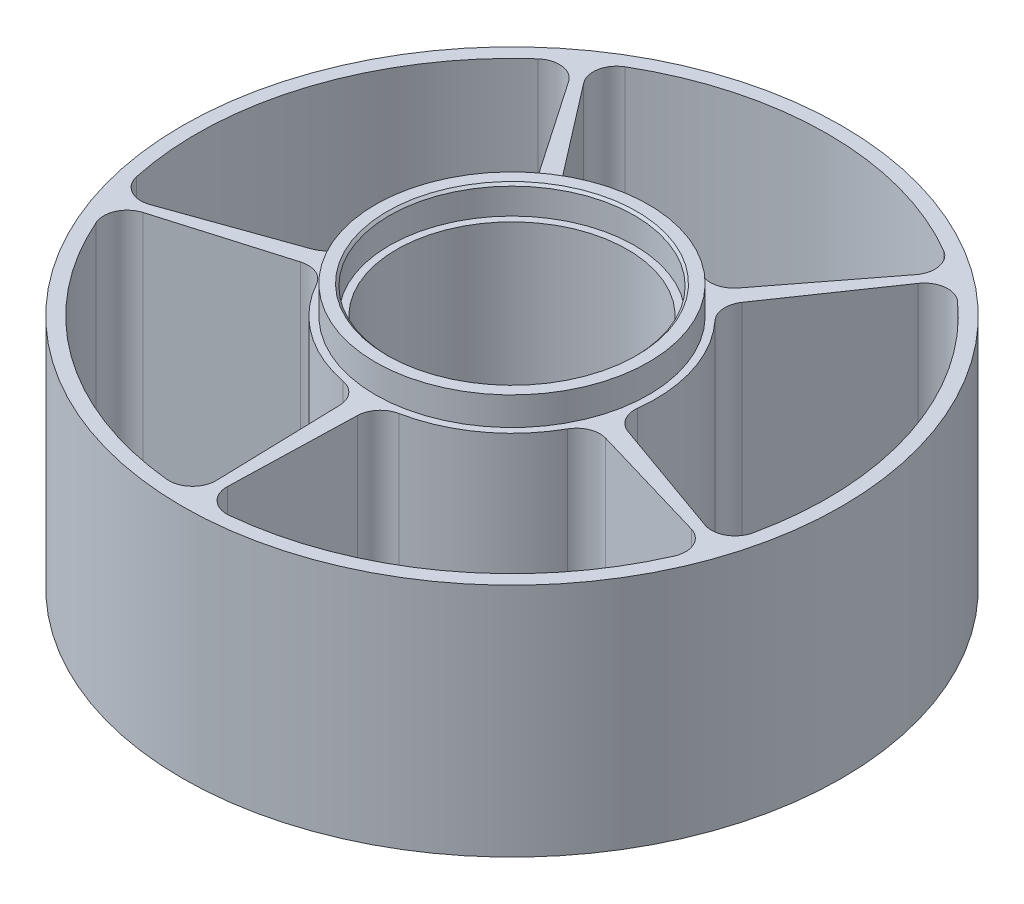
from build123d import *

# Parameters (mm, degrees)
SKETCH_1_W             = 6
SKETCH_1_H             = 50
SKETCH_1_W_2           = 3
HOLE_WIZARD_M4_1_D     = 3.3
HOLE_WIZARD_M4_1_DEPTH = 10
HOLE_WIZARD_M4_1_TIP   = 0.991420021
EXTRUDE_1_DEPTH        = 50
SKETCH_7_R             = 29
SKETCH_7_R_2           = 26
EXTRUDE_3_DEPTH        = 6
CHAMFER_1_SIZE         = 0.5
FILLET_1_R             = 5


with BuildPart() as part:
    # 草图1 → 旋转1 (revolve)
    with BuildSketch(Plane.XY, mode=Mode.PRIVATE) as revolve_1_sk:
        with Locations((27.5, 25)):
            Rectangle(SKETCH_1_W, SKETCH_1_H)
        with Locations((68.5, 25)):
            Rectangle(SKETCH_1_W_2, SKETCH_1_H)
    revolve(revolve_1_sk.sketch.rotate(Axis((0, 82.659451531, 0), (0, -1, 0)), 90), axis=Axis((0, 82.659451531, 0), (0, -1, 0)))

    # M4 螺纹孔1
    with Locations(Plane(origin=(0, 0, 0), x_dir=(-1, 0, 0), z_dir=(0, -1, 0))):
        with Locations((0, 27.5), (19.445436483, -19.445436483), (27.5, 0), (19.445436483, 19.445436483), (0, -27.5), (-19.445436483, -19.445436483), (-27.5, 0), (-19.445436483, 19.445436483)):
            Hole(HOLE_WIZARD_M4_1_D / 2, depth=HOLE_WIZARD_M4_1_DEPTH)
            with Locations((0, 0, -(HOLE_WIZARD_M4_1_DEPTH + HOLE_WIZARD_M4_1_TIP / 2))):  # 118° drill point
                Cone(0, HOLE_WIZARD_M4_1_D / 2, HOLE_WIZARD_M4_1_TIP, mode=Mode.SUBTRACT)

    # 草图5 → 凸台-拉伸1 (add)
    with BuildSketch(Plane(origin=(0, 50, 0), x_dir=(1, 0, 0), z_dir=(0, 1, 0))):
        with BuildLine():
            Line((1, -66.992536898), (2, -30.434355587))
            ThreePointArc((2, -30.434355587), (0, -30.5), (-2, -30.434355587))
            Line((-2, -30.434355587), (-1, -66.992536898))
            ThreePointArc((-1, -66.992536898), (0, -67), (1, -66.992536898))
        make_face()
        with BuildLine():
            ThreePointArc((-28.326758212, -11.306846122), (-29.007223747, -9.425018328), (-29.562826189, -7.502620057))
            Line((-29.562826189, -7.502620057), (-64.022705754, -19.750775881))
            ThreePointArc((-64.022705754, -19.750775881), (-63.720786592, -20.704138623), (-63.404671765, -21.652888914))
            Line((-63.404671765, -21.652888914), (-28.326758212, -11.306846122))
        make_face()
        with BuildLine():
            ThreePointArc((-19.506899366, 23.446340378), (-17.927450195, 24.675018328), (-16.270831388, 25.797481387))
            Line((-16.270831388, 25.797481387), (-38.568208208, 54.785886099))
            ThreePointArc((-38.568208208, 54.785886099), (-39.381611904, 54.204138623), (-40.186242197, 53.610315594))
            Line((-40.186242197, 53.610315594), (-19.506899366, 23.446340378))
        make_face()
        with BuildLine():
            ThreePointArc((16.270831388, 25.797481387), (17.927450195, 24.675018328), (19.506899366, 23.446340378))
            Line((19.506899366, 23.446340378), (40.186242197, 53.610315594))
            ThreePointArc((40.186242197, 53.610315594), (39.381611904, 54.204138623), (38.568208208, 54.785886099))
            Line((38.568208208, 54.785886099), (16.270831388, 25.797481387))
        make_face()
        with BuildLine():
            ThreePointArc((29.562826189, -7.502620057), (29.007223747, -9.425018328), (28.326758212, -11.306846122))
            Line((28.326758212, -11.306846122), (63.404671765, -21.652888914))
            ThreePointArc((63.404671765, -21.652888914), (63.720786592, -20.704138623), (64.022705754, -19.750775881))
            Line((64.022705754, -19.750775881), (29.562826189, -7.502620057))
        make_face()
    extrude(amount=-EXTRUDE_1_DEPTH)

    # 草图7 → 凸台-拉伸3 (add)
    with BuildSketch(Plane(origin=(0, 50, 0), x_dir=(1, 0, 0), z_dir=(0, 1, 0))):
        with Locations(Location((0, 0, 0), (0, 0, 270))):
            Circle(SKETCH_7_R)
        with Locations(Location((0, 0, 0), (0, 0, 270))):
            Circle(SKETCH_7_R_2, mode=Mode.SUBTRACT)
    extrude(amount=EXTRUDE_3_DEPTH)

    # 倒角1
    chamfer_1_edges = [part.edges().sort_by_distance(p)[0] for p in [
        (0, 56, -26),
        (0, 0, -24.5),
    ]]
    chamfer(chamfer_1_edges, length=CHAMFER_1_SIZE)

    # 圆角1
    fillet_1_edges = [part.edges().sort_by_distance(p)[0] for p in [
        (-2, 25, 30.434355587),
        (2, 25, 30.434355587),
        (1, 25, 66.992536898),
        (-1, 25, 66.992536898),
        (-29.562826189, 25, 7.502620057),
        (-28.326758212, 25, 11.306846122),
        (-63.404671765, 25, 21.652888914),
        (-64.022705754, 25, 19.750775881),
        (-16.270831388, 25, -25.797481387),
        (-19.506899366, 25, -23.446340378),
        (-40.186242197, 25, -53.610315594),
        (-38.568208208, 25, -54.785886099),
        (19.506899366, 25, -23.446340378),
        (16.270831388, 25, -25.797481387),
        (38.568208208, 25, -54.785886099),
        (40.186242197, 25, -53.610315594),
        (28.326758212, 25, 11.306846122),
        (29.562826189, 25, 7.502620057),
        (64.022705754, 25, 19.750775881),
        (63.404671765, 25, 21.652888914),
    ]]
    fillet(fillet_1_edges, radius=FILLET_1_R)


solid = part.part
